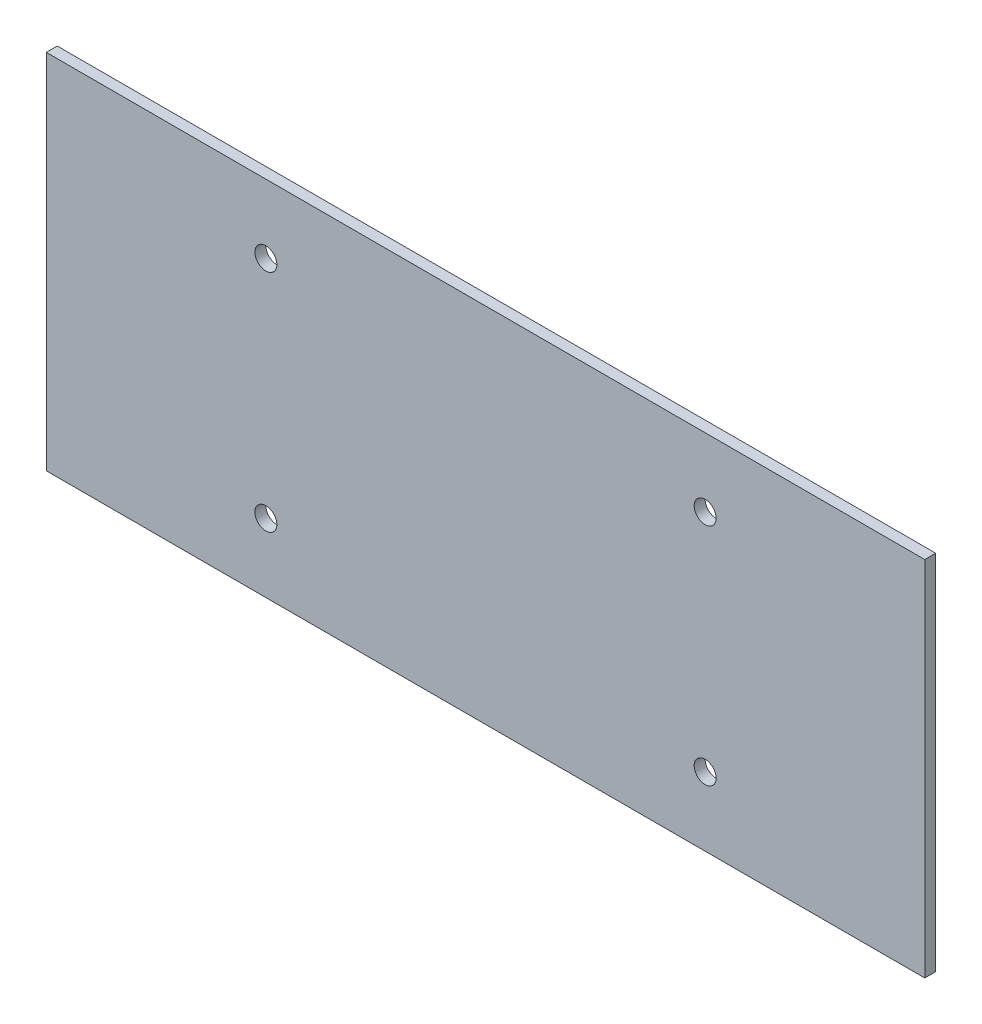
from build123d import *

# Parameters (mm, degrees)
SKETCH1_W           = 160
SKETCH1_H           = 66
BOSS_EXTRUDE1_DEPTH = 2
SKETCH2_R           = 2
CUT_EXTRUDE1_DEPTH  = 174.089572187


with BuildPart() as part:
    # Sketch1 → Boss-Extrude1 (new body)
    with BuildSketch(Plane.XY):
        with Locations((80, 33)):
            Rectangle(SKETCH1_W, SKETCH1_H)
    extrude(amount=BOSS_EXTRUDE1_DEPTH)

    # Sketch2 → Cut-Extrude1 (cut, through all)
    with BuildSketch(Plane.XY.offset(2)):
        with Locations((40, 53.5)):
            Circle(SKETCH2_R)
        with Locations((120, 53.5)):
            Circle(SKETCH2_R)
        with Locations((40, 12.5)):
            Circle(SKETCH2_R)
        with Locations((120, 12.5)):
            Circle(SKETCH2_R)
    extrude(amount=-CUT_EXTRUDE1_DEPTH, mode=Mode.SUBTRACT)


solid = part.part
